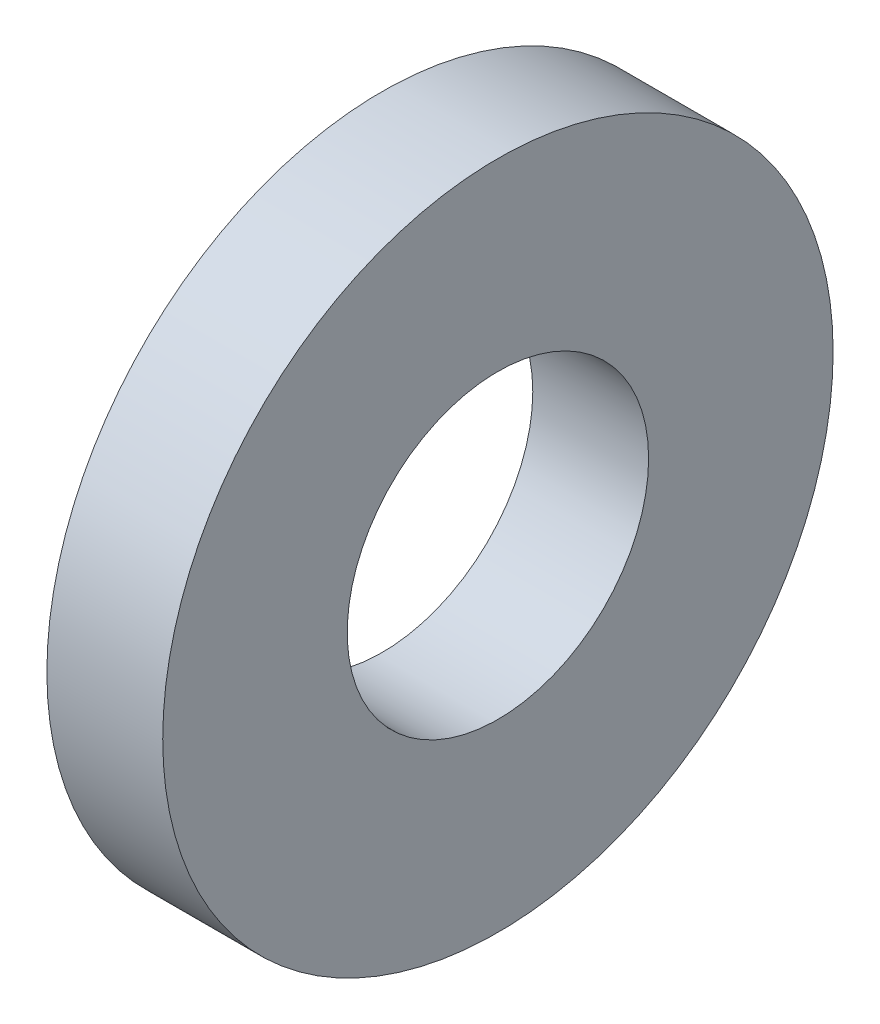
from build123d import *

# Parameters (mm, degrees)
SKETCH1_R           = 7.9375
SKETCH1_R_2         = 3.5687
BOSS_EXTRUDE1_DEPTH = 2.7432


with BuildPart() as part:
    # Sketch1 → Boss-Extrude1 (new body)
    with BuildSketch(Plane(origin=(0, 0, 0), x_dir=(0, 0, -1), z_dir=(1, 0, 0))):
        Circle(SKETCH1_R)
        Circle(SKETCH1_R_2, mode=Mode.SUBTRACT)
    extrude(amount=BOSS_EXTRUDE1_DEPTH)


solid = part.part
